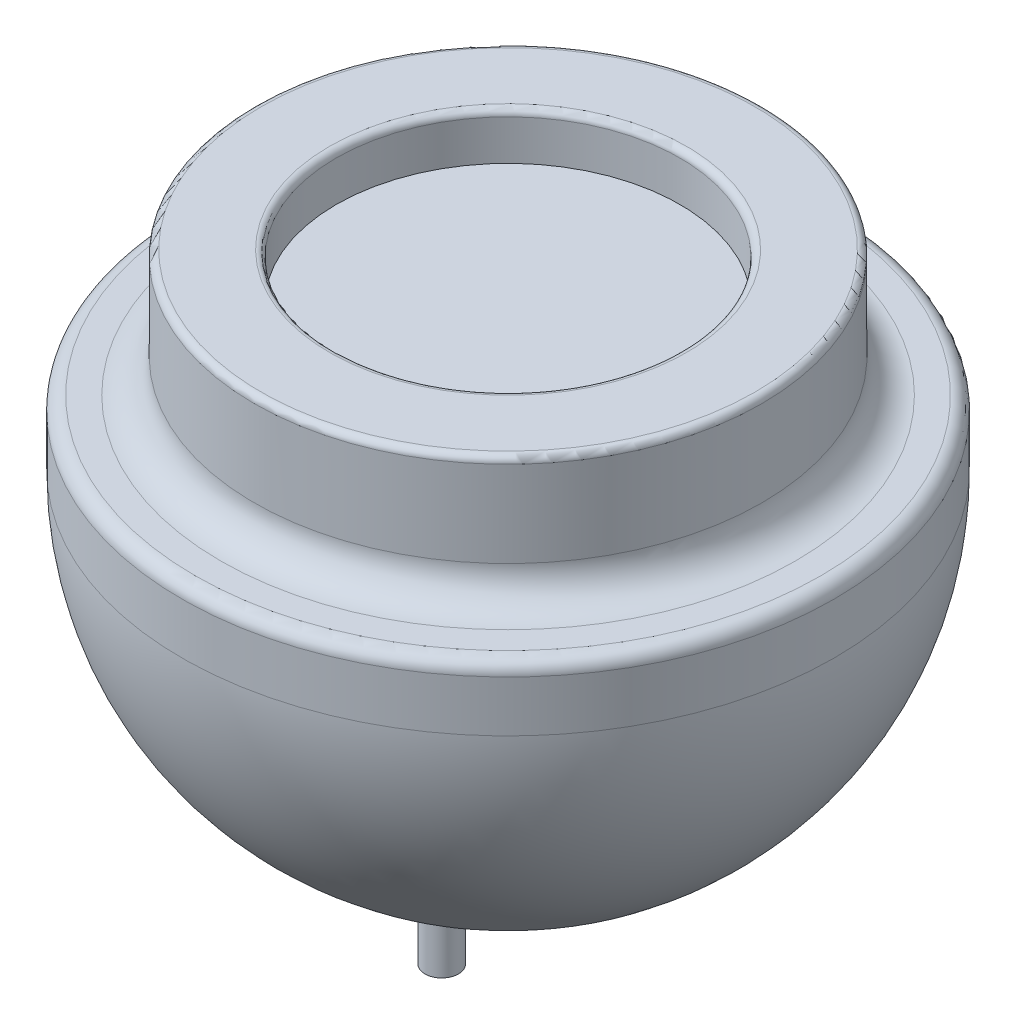
from build123d import *

# Parameters (mm, degrees)
FILLET1_R           = 10
SKETCH2_R           = 25
BOSS_EXTRUDE1_DEPTH = 80
CIRPATTERN1_COUNT   = 3


with BuildPart() as part:
    # Sketch1 → Revolve1 (revolve)
    with BuildSketch(Plane.XY):
        with BuildLine():
            Line((0, 214), (256, 214))
            Line((256, 214), (256, 284))
            Line((256, 284), (378, 284))
            Line((378, 284), (378, 146))
            ThreePointArc((378, 146), (392.644660941, 110.644660941), (428, 96))
            Line((428, 96), (466, 96))
            ThreePointArc((466, 96), (480.142135624, 90.142135624), (486, 76))
            Line((486, 76), (486, 0))
            ThreePointArc((486, 0), (400.474718303, -275.347053734), (174, -453.784089629))
            Line((174, -453.784089629), (0, -453.784089629))
            Line((0, -453.784089629), (0, 214))
        make_face()
    revolve(axis=Axis((0, -1000, 0), (0, 1, 0)))

    # Fillet1
    fillet1_edges = [part.edges().sort_by_distance(p)[0] for p in [
        (-256, 284, 0),
        (-378, 284, 0),
    ]]
    fillet(fillet1_edges, radius=FILLET1_R)

    # Sketch2 → Boss-Extrude1 (add)
    with BuildSketch(Plane.XZ.offset(453.784089629)):
        with Locations((-270, 0)):
            Circle(SKETCH2_R)
    boss_extrude1 = extrude(amount=-BOSS_EXTRUDE1_DEPTH)

    # CirPattern1: Boss-Extrude1 ×3 about axis
    cirpattern1_axis = Axis((0, 0, 0), (0, 1, 0))
    for i in range(1, CIRPATTERN1_COUNT):
        add(boss_extrude1.rotate(cirpattern1_axis, i * 360 / CIRPATTERN1_COUNT))


solid = part.part
